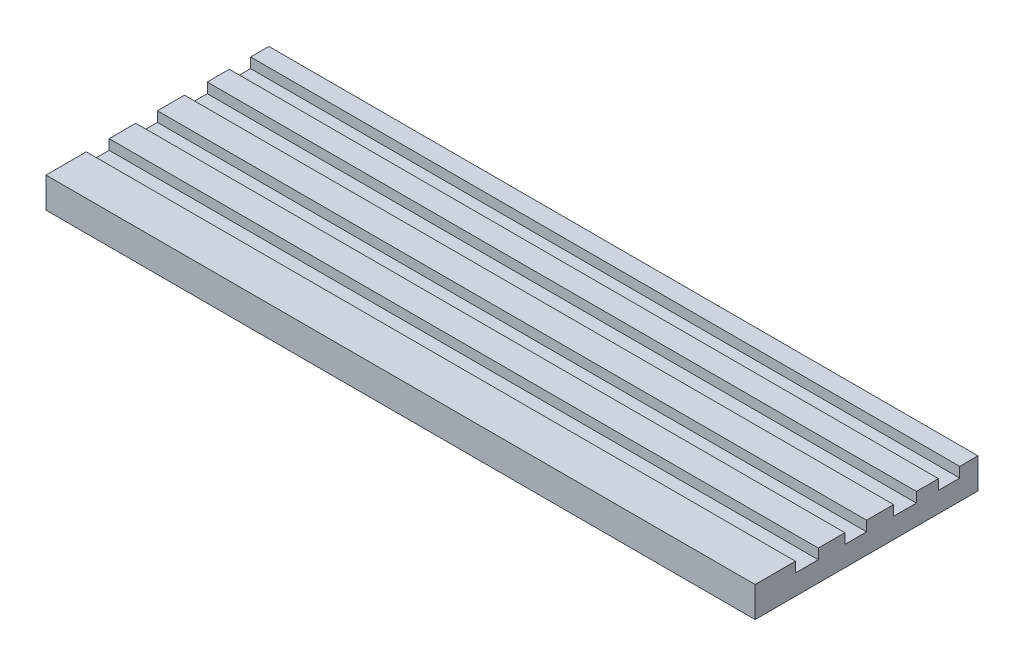
from build123d import *

# Parameters (mm, degrees)
SKETCH2_W           = 70
SKETCH2_H           = 22
BOSS_EXTRUDE1_DEPTH = 3
SKETCH3_W           = 70
SKETCH3_H           = 2.102295328
SKETCH3_H_2         = 2.252459279
SKETCH3_H_3         = 2.139836316
SKETCH3_H_4         = 2.25245928
CUT_EXTRUDE1_DEPTH  = 1


with BuildPart() as part:
    # Sketch2 → Boss-Extrude1 (new body)
    with BuildSketch(Plane(origin=(0, 0, 0), x_dir=(1, 0, 0), z_dir=(0, 1, 0))):
        with Locations((35, 11)):
            Rectangle(SKETCH2_W, SKETCH2_H)
    extrude(amount=BOSS_EXTRUDE1_DEPTH)

    # Sketch3 → Cut-Extrude1 (cut)
    with BuildSketch(Plane(origin=(0, 3, 0), x_dir=(1, 0, 0), z_dir=(0, 1, 0))):
        with Locations((35, 19.146394395)):
            Rectangle(SKETCH3_W, SKETCH3_H)
        with Locations((35, 14.791639788)):
            Rectangle(SKETCH3_W, SKETCH3_H_2)
        with Locations((35, 9.930081842)):
            Rectangle(SKETCH3_W, SKETCH3_H_3)
        with Locations((35, 5.106064885)):
            Rectangle(SKETCH3_W, SKETCH3_H_4)
    extrude(amount=-CUT_EXTRUDE1_DEPTH, mode=Mode.SUBTRACT)


solid = part.part
